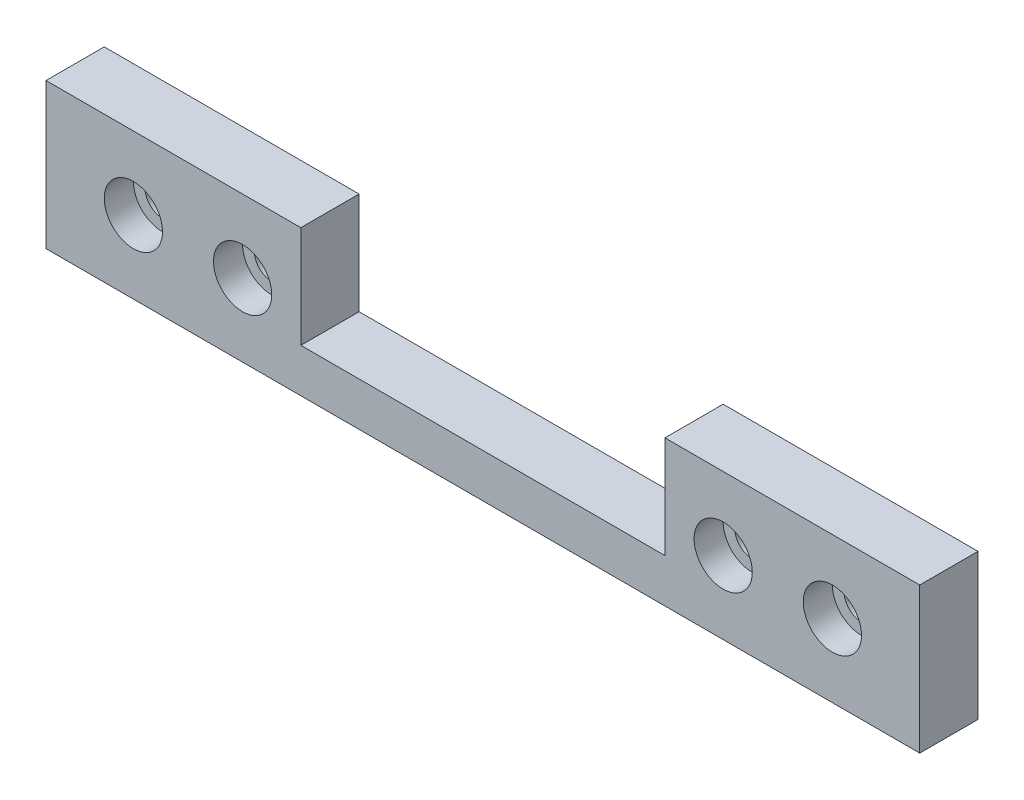
from build123d import *

# Parameters (mm, degrees)
SKETCH_1_W                   = 120
SKETCH_1_H                   = 20
EXTRUDE_1_DEPTH              = 8
SKETCH_2_W                   = 50
SKETCH_2_H                   = 14
CUT_EXTRUDE_1_DEPTH          = 122.918005233
HOLE_WIZARD_M4_1_D           = 4.8
HOLE_WIZARD_M4_1_CBORE_D     = 8
HOLE_WIZARD_M4_1_CBORE_DEPTH = 4


with BuildPart() as part:
    # 草图1 → 凸台-拉伸1 (new body)
    with BuildSketch(Plane.XY):
        with Locations((60, 10)):
            Rectangle(SKETCH_1_W, SKETCH_1_H)
    extrude(amount=EXTRUDE_1_DEPTH)

    # 草图2 → 切除-拉伸1 (cut, through all)
    with BuildSketch(Plane.XY.offset(8)):
        with Locations((60, 13)):
            Rectangle(SKETCH_2_W, SKETCH_2_H)
    extrude(amount=-CUT_EXTRUDE_1_DEPTH, mode=Mode.SUBTRACT)

    # M4 六角凹头螺钉的柱形沉头孔1 (through all)
    with Locations(Plane.XY.offset(8)):
        with Locations((12, 10), (27, 10), (93, 10), (108, 10)):
            CounterBoreHole(HOLE_WIZARD_M4_1_D / 2, HOLE_WIZARD_M4_1_CBORE_D / 2, HOLE_WIZARD_M4_1_CBORE_DEPTH)


solid = part.part
